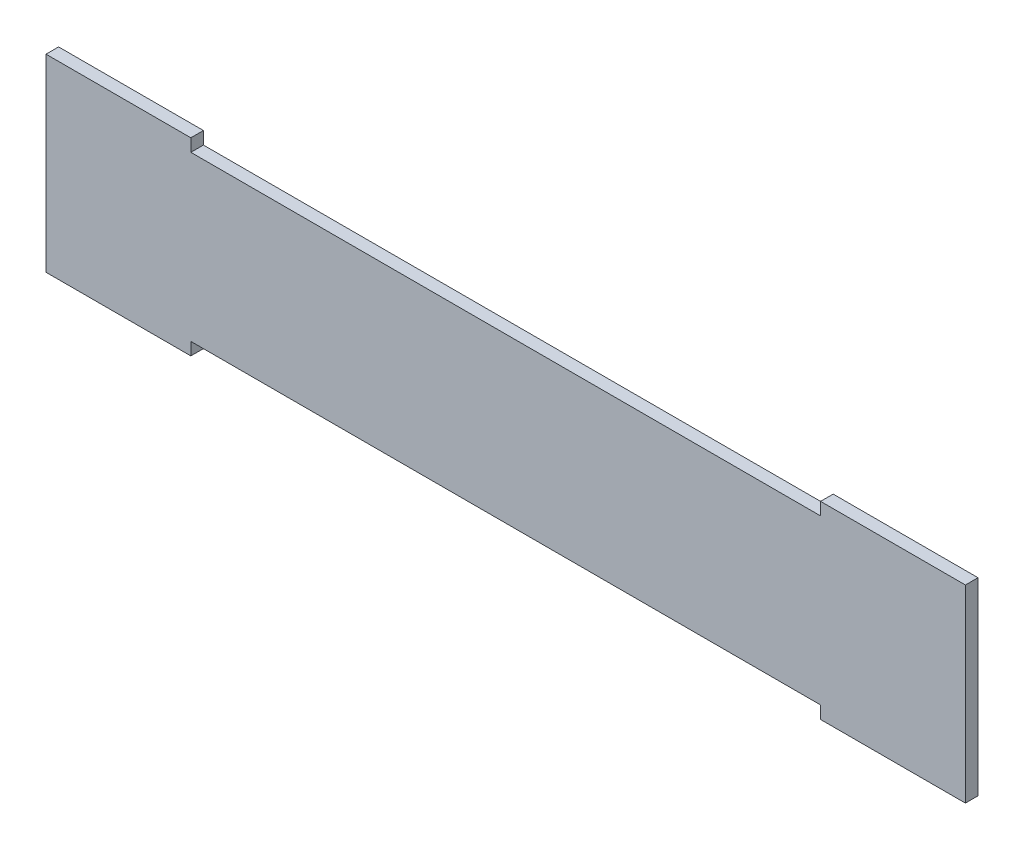
from build123d import *

# Parameters (mm, degrees)
BOSS_EXTRUDE1_DEPTH = 2


with BuildPart() as part:
    # Sketch1 → Boss-Extrude1 (new body)
    with BuildSketch(Plane.XY):
        Polygon((0, 0), (0, -15), (23, -15), (23, -13), (123, -13), (123, -15), (146, -15), (146, 0), align=None)
    boss_extrude1 = extrude(amount=BOSS_EXTRUDE1_DEPTH)

    # Mirror3: Boss-Extrude1 across plane
    add(boss_extrude1.mirror(Plane(origin=(0, 0, 2), x_dir=(0, 0, 1), z_dir=(0, -1, 0))))


solid = part.part
